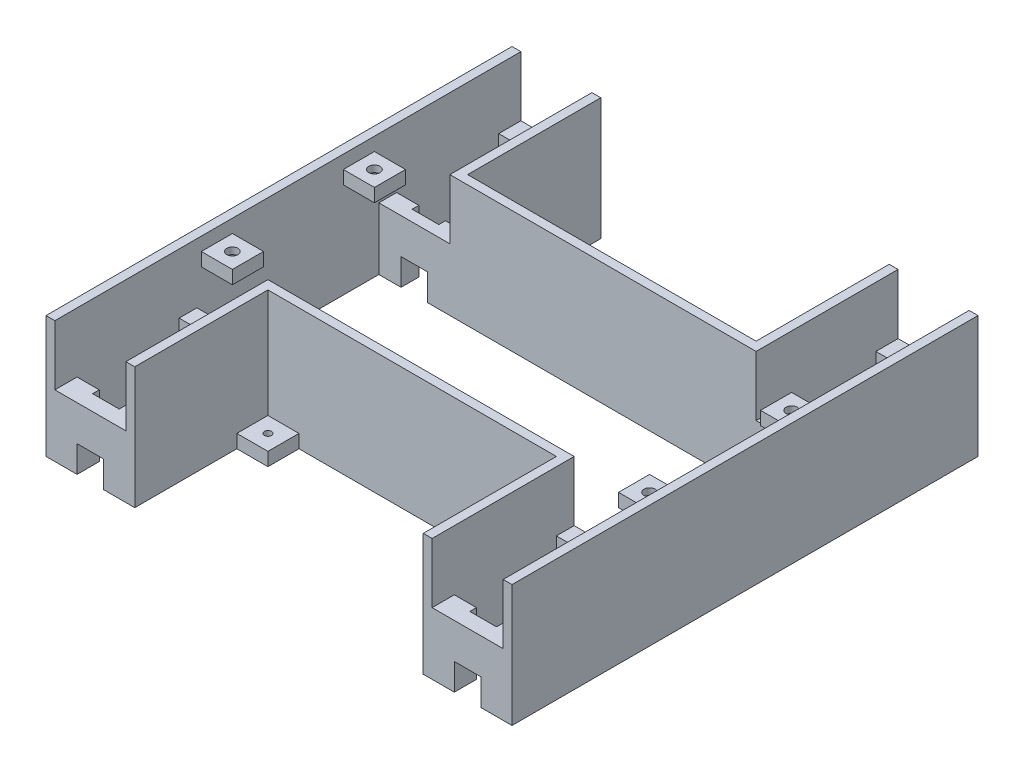
from build123d import *

# Parameters (mm, degrees)
SKETCH_1_W          = 65
SKETCH_1_H          = 2
EXTRUDE_2_DEPTH     = 27.5
SKETCH_2_W          = 16
SKETCH_2_H          = 5
SKETCH_2_H_2        = 4
EXTRUDE_3_DEPTH     = 14
SKETCH_2_3_W        = 105
SKETCH_2_3_H        = 2
CUT_EXTRUDE_1_DEPTH = 120.73094838
EXTRUDE_START       = -24.5
SKETCH_3_W          = 7
SKETCH_3_H          = 7
SKETCH_3_R          = 1.25
EXTRUDE_4_DEPTH     = 3
EXTRUDE_4_2_DEPTH   = 3
EXTRUDE_4_3_DEPTH   = 3
EXTRUDE_4_4_DEPTH   = 3
CUT_EXTRUDE_START   = -21.5
SKETCH_3_4_R        = 2
CUT_EXTRUDE_3_DEPTH = 1.5
SKETCH_4_W          = 7
SKETCH_4_H          = 7
SKETCH_4_R          = 0.8
EXTRUDE_5_DEPTH     = 3
EXTRUDE_5_2_DEPTH   = 3
EXTRUDE_5_3_DEPTH   = 3
EXTRUDE_5_4_DEPTH   = 3
SKETCH_5_W          = 6
SKETCH_5_H          = 6
CUT_EXTRUDE_4_DEPTH = 150.633719462
SKETCH_6_W          = 6
SKETCH_6_H          = 1.5
CUT_EXTRUDE_5_DEPTH = 118.590390764


with BuildPart() as part:
    # 草图1 → 凸台-拉伸2 (new body)
    with BuildSketch(Plane(origin=(0, 0, 0), x_dir=(1, 0, 0), z_dir=(0, 1, 0))):
        Polygon((0, 52.5), (-2, 52.5), (-2, -52.5), (0, -52.5), (0, -20.5), (0, 20.5), align=None)
        Polygon((-2, 52.5), (0, 52.5), (16, 52.5), (18, 52.5), (18, 54.5), (-2, 54.5), align=None)
        Polygon((16, 52.5), (16, 20.5), (18, 20.5), (18, 22.5), (18, 52.5), align=None)
        with Locations((50.5, 21.5)):
            Rectangle(SKETCH_1_W, SKETCH_1_H)
        Polygon((83, 22.5), (83, 20.5), (85, 20.5), (85, 52.5), (83, 52.5), align=None)
        Polygon((83, 52.5), (85, 52.5), (101, 52.5), (103, 52.5), (103, 54.5), (83, 54.5), align=None)
        Polygon((103, 52.5), (103, -52.5), (101, -52.5), (101, -20.5), (101, 20.5), (101, 52.5), align=None)
        Polygon((101, -52.5), (85, -52.5), (83, -52.5), (83, -54.5), (103, -54.5), (103, -52.5), align=None)
        Polygon((85, -20.5), (83, -20.5), (83, -22.5), (83, -52.5), (85, -52.5), align=None)
        with Locations((50.5, -21.5)):
            Rectangle(SKETCH_1_W, SKETCH_1_H)
        Polygon((18, -20.5), (16, -20.5), (16, -52.5), (18, -52.5), (18, -22.5), align=None)
        Polygon((16, -52.5), (0, -52.5), (-2, -52.5), (-2, -54.5), (18, -54.5), (18, -52.5), align=None)
    extrude(amount=EXTRUDE_2_DEPTH)

    # 草图2 → 凸台-拉伸3 (add)
    with BuildSketch(Plane.XZ):
        with Locations((8, 50)):
            Rectangle(SKETCH_2_W, SKETCH_2_H)
        with Locations((93, 50)):
            Rectangle(SKETCH_2_W, SKETCH_2_H)
        with Locations((8, -50)):
            Rectangle(SKETCH_2_W, SKETCH_2_H)
        with Locations((93, -50)):
            Rectangle(SKETCH_2_W, SKETCH_2_H)
        with Locations((8, 22.5)):
            Rectangle(SKETCH_2_W, SKETCH_2_H_2)
        with Locations((93, 22.5)):
            Rectangle(SKETCH_2_W, SKETCH_2_H_2)
        with Locations((93, -22.5)):
            Rectangle(SKETCH_2_W, SKETCH_2_H_2)
        with Locations((8, -22.5)):
            Rectangle(SKETCH_2_W, SKETCH_2_H_2)
    extrude(amount=-EXTRUDE_3_DEPTH)

    # 草图2<3> → 切除-拉伸1 (cut, through all)
    with BuildSketch(Plane.XZ):
        with Locations((50.5, 53.5)):
            Rectangle(SKETCH_2_3_W, SKETCH_2_3_H)
        with Locations((50.5, -53.5)):
            Rectangle(SKETCH_2_3_W, SKETCH_2_3_H)
    extrude(amount=-CUT_EXTRUDE_1_DEPTH, mode=Mode.SUBTRACT)

    # 草图5 → 切除-拉伸4 (cut, through all)
    with BuildSketch(Plane.XY.offset(52.5)):
        with Locations((8, 3)):
            Rectangle(SKETCH_5_W, SKETCH_5_H)
        with Locations((93, 3)):
            Rectangle(SKETCH_5_W, SKETCH_5_H)
    extrude(amount=-CUT_EXTRUDE_4_DEPTH, mode=Mode.SUBTRACT)

    # 草图6 → 切除-拉伸5 (cut, through all)
    with BuildSketch(Plane.XZ.offset(-6)):
        with Locations((8, 48.25)):
            Rectangle(SKETCH_6_W, SKETCH_6_H)
        with Locations((8, 23.75)):
            Rectangle(SKETCH_6_W, SKETCH_6_H)
        with Locations((93, 23.75)):
            Rectangle(SKETCH_6_W, SKETCH_6_H)
        with Locations((93, 48.25)):
            Rectangle(SKETCH_6_W, SKETCH_6_H)
        with Locations((93, -23.75)):
            Rectangle(SKETCH_6_W, SKETCH_6_H)
        with Locations((93, -48.25)):
            Rectangle(SKETCH_6_W, SKETCH_6_H)
        with Locations((8, -48.25)):
            Rectangle(SKETCH_6_W, SKETCH_6_H)
        with Locations((8, -23.75)):
            Rectangle(SKETCH_6_W, SKETCH_6_H)
    extrude(amount=-CUT_EXTRUDE_5_DEPTH, mode=Mode.SUBTRACT)


with BuildPart() as body_2:
    # 草图3 → 凸台-拉伸4 (new body)
    with BuildSketch(Plane.XZ.offset(EXTRUDE_START)):
        with Locations((3.5, 16)):
            Rectangle(SKETCH_3_W, SKETCH_3_H)
        with Locations(Location((3.5, 16, 0), (0, 0, 270))):
            Circle(SKETCH_3_R, mode=Mode.SUBTRACT)
    extrude(amount=EXTRUDE_4_DEPTH)


with BuildPart() as body_3:
    # 草图3 → Extrude 4 2 (new body)
    with BuildSketch(Plane.XZ.offset(EXTRUDE_START)):
        with Locations((3.5, -16)):
            Rectangle(SKETCH_3_W, SKETCH_3_H)
        with Locations(Location((3.5, -16, 0), (0, 0, 270))):
            Circle(SKETCH_3_R, mode=Mode.SUBTRACT)
    extrude(amount=EXTRUDE_4_2_DEPTH)


with BuildPart() as body_4:
    # 草图3 → Extrude 4 3 (new body)
    with BuildSketch(Plane.XZ.offset(EXTRUDE_START)):
        with Locations((97.5, 16)):
            Rectangle(SKETCH_3_W, SKETCH_3_H)
        with Locations(Location((97.5, 16, 0), (0, 0, 270))):
            Circle(SKETCH_3_R, mode=Mode.SUBTRACT)
    extrude(amount=EXTRUDE_4_3_DEPTH)


with BuildPart() as body_5:
    # 草图3 → Extrude 4 4 (new body)
    with BuildSketch(Plane.XZ.offset(EXTRUDE_START)):
        with Locations((97.5, -16)):
            Rectangle(SKETCH_3_W, SKETCH_3_H)
        with Locations(Location((97.5, -16, 0), (0, 0, 270))):
            Circle(SKETCH_3_R, mode=Mode.SUBTRACT)
    extrude(amount=EXTRUDE_4_4_DEPTH)


with BuildPart() as cut_extrude_3_tool:
    # 草图3<4> → 切除-拉伸3 (new body)
    with BuildSketch(Plane.XZ.offset(CUT_EXTRUDE_START)):
        with Locations(Location((3.5, 16, 0), (0, 0, 90))):
            Circle(SKETCH_3_4_R)
        with Locations(Location((97.5, 16, 0), (0, 0, 90))):
            Circle(SKETCH_3_4_R)
        with Locations(Location((97.5, -16, 0), (0, 0, 90))):
            Circle(SKETCH_3_4_R)
        with Locations(Location((3.5, -16, 0), (0, 0, 90))):
            Circle(SKETCH_3_4_R)
    extrude(amount=-CUT_EXTRUDE_3_DEPTH)


with BuildPart() as body_2_1:
    add(body_2.part)

    # 切除-拉伸3: cut by cut_extrude_3_tool
    add(cut_extrude_3_tool.part, mode=Mode.SUBTRACT)


with BuildPart() as body_3_1:
    add(body_3.part)

    # 切除-拉伸3: cut by cut_extrude_3_tool
    add(cut_extrude_3_tool.part, mode=Mode.SUBTRACT)


with BuildPart() as body_4_1:
    add(body_4.part)

    # 切除-拉伸3: cut by cut_extrude_3_tool
    add(cut_extrude_3_tool.part, mode=Mode.SUBTRACT)


with BuildPart() as body_5_1:
    add(body_5.part)

    # 切除-拉伸3: cut by cut_extrude_3_tool
    add(cut_extrude_3_tool.part, mode=Mode.SUBTRACT)


with BuildPart() as body_6:
    # 草图4 → 凸台-拉伸5 (new body)
    with BuildSketch(Plane.XZ):
        with Locations((21.5, 26)):
            Rectangle(SKETCH_4_W, SKETCH_4_H)
        with Locations(Location((21.5, 26, 0), (0, 0, 270))):
            Circle(SKETCH_4_R, mode=Mode.SUBTRACT)
    extrude(amount=-EXTRUDE_5_DEPTH)


with BuildPart() as body_7:
    # 草图4 → Extrude 5 2 (new body)
    with BuildSketch(Plane.XZ):
        with Locations((79.5, 26)):
            Rectangle(SKETCH_4_W, SKETCH_4_H)
        with Locations(Location((79.5, 26, 0), (0, 0, 270))):
            Circle(SKETCH_4_R, mode=Mode.SUBTRACT)
    extrude(amount=-EXTRUDE_5_2_DEPTH)


with BuildPart() as body_8:
    # 草图4 → Extrude 5 3 (new body)
    with BuildSketch(Plane.XZ):
        with Locations((21.5, -26)):
            Rectangle(SKETCH_4_W, SKETCH_4_H)
        with Locations(Location((21.5, -26, 0), (0, 0, 270))):
            Circle(SKETCH_4_R, mode=Mode.SUBTRACT)
    extrude(amount=-EXTRUDE_5_3_DEPTH)


with BuildPart() as body_9:
    # 草图4 → Extrude 5 4 (new body)
    with BuildSketch(Plane.XZ):
        with Locations((79.5, -26)):
            Rectangle(SKETCH_4_W, SKETCH_4_H)
        with Locations(Location((79.5, -26, 0), (0, 0, 270))):
            Circle(SKETCH_4_R, mode=Mode.SUBTRACT)
    extrude(amount=-EXTRUDE_5_4_DEPTH)


solid = Compound([part.part, body_2_1.part, body_3_1.part, body_4_1.part, body_5_1.part, body_6.part, body_7.part, body_8.part, body_9.part])
